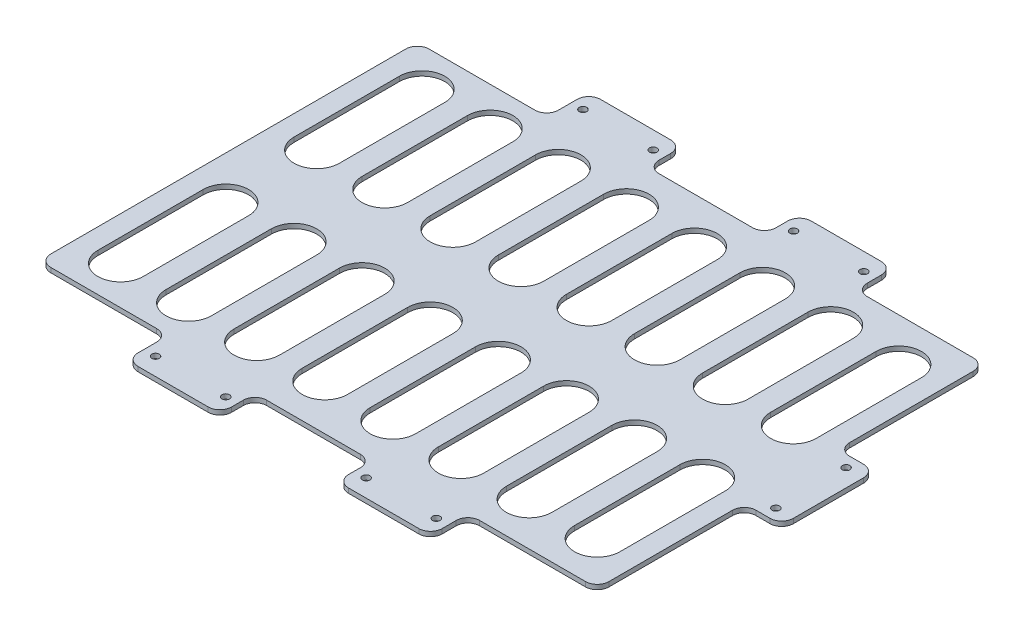
from build123d import *

# Parameters (mm, degrees)
SKETCH_1_R          = 1.6
EXTRUDE_1_DEPTH     = 2
CUT_EXTRUDE_3_DEPTH = 169.328378846
CUT_EXTRUDE_4_DEPTH = 169.328378846
FILLET_2_R          = 5


with BuildPart() as part:
    # 草图1 → 凸台-拉伸1 (new body)
    with BuildSketch(Plane(origin=(0, 0, 0), x_dir=(1, 0, 0), z_dir=(0, 1, 0))):
        Polygon((-121.25, 83.825), (-121.25, -83.825), (-65, -83.825), (-65, -98.825), (-25, -98.825), (-25, -83.825), (25, -83.825), (25, -98.825), (65, -98.825), (65, -83.825), (121.25, -83.825), (121.25, -20), (136.25, -20), (136.25, 20), (121.25, 20), (121.25, 83.825), (65, 83.825), (65, 98.825), (25, 98.825), (25, 83.825), (-25, 83.825), (-25, 98.825), (-65, 98.825), (-65, 83.825), align=None)
        with Locations(Location((-30, -91.325, 0), (0, 0, 270))):
            Circle(SKETCH_1_R, mode=Mode.SUBTRACT)
        with Locations(Location((-60, -91.325, 0), (0, 0, 270))):
            Circle(SKETCH_1_R, mode=Mode.SUBTRACT)
        with Locations(Location((-30, 91.325, 0), (0, 0, 270))):
            Circle(SKETCH_1_R, mode=Mode.SUBTRACT)
        with Locations(Location((-60, 91.325, 0), (0, 0, 270))):
            Circle(SKETCH_1_R, mode=Mode.SUBTRACT)
        with Locations(Location((60, -91.325, 0), (0, 0, 270))):
            Circle(SKETCH_1_R, mode=Mode.SUBTRACT)
        with Locations(Location((30, -91.325, 0), (0, 0, 270))):
            Circle(SKETCH_1_R, mode=Mode.SUBTRACT)
        with Locations(Location((60, 91.325, 0), (0, 0, 270))):
            Circle(SKETCH_1_R, mode=Mode.SUBTRACT)
        with Locations(Location((30, 91.325, 0), (0, 0, 270))):
            Circle(SKETCH_1_R, mode=Mode.SUBTRACT)
        with Locations(Location((128.75, 15, 0), (0, 0, 270))):
            Circle(SKETCH_1_R, mode=Mode.SUBTRACT)
        with Locations(Location((128.75, -15, 0), (0, 0, 270))):
            Circle(SKETCH_1_R, mode=Mode.SUBTRACT)
    extrude(amount=EXTRUDE_1_DEPTH)

    # 草图4 → 切除-拉伸3 (cut, through all)
    with BuildSketch(Plane(origin=(0, 2, 0), x_dir=(1, 0, 0), z_dir=(0, 1, 0))):
        with BuildLine():
            Line((-92.15, 64.425), (-92.15, 19.4))
            ThreePointArc((-92.15, 19.4), (-101.85, 9.7), (-111.55, 19.4))
            Line((-111.55, 19.4), (-111.55, 64.425))
            ThreePointArc((-111.55, 64.425), (-101.85, 74.125), (-92.15, 64.425))
        make_face()
        with BuildLine():
            Line((-63.05, 64.425), (-63.05, 19.4))
            ThreePointArc((-63.05, 19.4), (-72.75, 9.7), (-82.45, 19.4))
            Line((-82.45, 19.4), (-82.45, 64.425))
            ThreePointArc((-82.45, 64.425), (-72.75, 74.125), (-63.05, 64.425))
        make_face()
        with BuildLine():
            Line((-33.95, 64.425), (-33.95, 19.4))
            ThreePointArc((-33.95, 19.4), (-43.65, 9.7), (-53.35, 19.4))
            Line((-53.35, 19.4), (-53.35, 64.425))
            ThreePointArc((-53.35, 64.425), (-43.65, 74.125), (-33.95, 64.425))
        make_face()
        with BuildLine():
            Line((-4.85, 64.425), (-4.85, 19.4))
            ThreePointArc((-4.85, 19.4), (-14.55, 9.7), (-24.25, 19.4))
            Line((-24.25, 19.4), (-24.25, 64.425))
            ThreePointArc((-24.25, 64.425), (-14.55, 74.125), (-4.85, 64.425))
        make_face()
        with BuildLine():
            Line((24.25, 64.425), (24.25, 19.4))
            ThreePointArc((24.25, 19.4), (14.55, 9.7), (4.85, 19.4))
            Line((4.85, 19.4), (4.85, 64.425))
            ThreePointArc((4.85, 64.425), (14.55, 74.125), (24.25, 64.425))
        make_face()
        with BuildLine():
            Line((53.35, 64.425), (53.35, 19.4))
            ThreePointArc((53.35, 19.4), (43.65, 9.7), (33.95, 19.4))
            Line((33.95, 19.4), (33.95, 64.425))
            ThreePointArc((33.95, 64.425), (43.65, 74.125), (53.35, 64.425))
        make_face()
        with BuildLine():
            Line((82.45, 64.425), (82.45, 19.4))
            ThreePointArc((82.45, 19.4), (72.75, 9.7), (63.05, 19.4))
            Line((63.05, 19.4), (63.05, 64.425))
            ThreePointArc((63.05, 64.425), (72.75, 74.125), (82.45, 64.425))
        make_face()
        with BuildLine():
            Line((111.55, 64.425), (111.55, 19.4))
            ThreePointArc((111.55, 19.4), (101.85, 9.7), (92.15, 19.4))
            Line((92.15, 19.4), (92.15, 64.425))
            ThreePointArc((92.15, 64.425), (101.85, 74.125), (111.55, 64.425))
        make_face()
        with BuildLine():
            Line((111.55, -64.425), (111.55, -19.4))
            ThreePointArc((111.55, -19.4), (101.85, -9.7), (92.15, -19.4))
            Line((92.15, -19.4), (92.15, -64.425))
            ThreePointArc((92.15, -64.425), (101.85, -74.125), (111.55, -64.425))
        make_face()
        with BuildLine():
            Line((82.45, -64.425), (82.45, -19.4))
            ThreePointArc((82.45, -19.4), (72.75, -9.7), (63.05, -19.4))
            Line((63.05, -19.4), (63.05, -64.425))
            ThreePointArc((63.05, -64.425), (72.75, -74.125), (82.45, -64.425))
        make_face()
        with BuildLine():
            Line((53.35, -64.425), (53.35, -19.4))
            ThreePointArc((53.35, -19.4), (43.65, -9.7), (33.95, -19.4))
            Line((33.95, -19.4), (33.95, -64.425))
            ThreePointArc((33.95, -64.425), (43.65, -74.125), (53.35, -64.425))
        make_face()
        with BuildLine():
            Line((24.25, -64.425), (24.25, -19.4))
            ThreePointArc((24.25, -19.4), (14.55, -9.7), (4.85, -19.4))
            Line((4.85, -19.4), (4.85, -64.425))
            ThreePointArc((4.85, -64.425), (14.55, -74.125), (24.25, -64.425))
        make_face()
        with BuildLine():
            Line((-4.85, -64.425), (-4.85, -19.4))
            ThreePointArc((-4.85, -19.4), (-14.55, -9.7), (-24.25, -19.4))
            Line((-24.25, -19.4), (-24.25, -64.425))
            ThreePointArc((-24.25, -64.425), (-14.55, -74.125), (-4.85, -64.425))
        make_face()
        with BuildLine():
            Line((-33.95, -64.425), (-33.95, -19.4))
            ThreePointArc((-33.95, -19.4), (-43.65, -9.7), (-53.35, -19.4))
            Line((-53.35, -19.4), (-53.35, -64.425))
            ThreePointArc((-53.35, -64.425), (-43.65, -74.125), (-33.95, -64.425))
        make_face()
        with BuildLine():
            Line((-63.05, -64.425), (-63.05, -19.4))
            ThreePointArc((-63.05, -19.4), (-72.75, -9.7), (-82.45, -19.4))
            Line((-82.45, -19.4), (-82.45, -64.425))
            ThreePointArc((-82.45, -64.425), (-72.75, -74.125), (-63.05, -64.425))
        make_face()
        with BuildLine():
            Line((-92.15, -64.425), (-92.15, -19.4))
            ThreePointArc((-92.15, -19.4), (-101.85, -9.7), (-111.55, -19.4))
            Line((-111.55, -19.4), (-111.55, -64.425))
            ThreePointArc((-111.55, -64.425), (-101.85, -74.125), (-92.15, -64.425))
        make_face()
    extrude(amount=-CUT_EXTRUDE_3_DEPTH, mode=Mode.SUBTRACT)

    # 草图5 → 切除-拉伸4 (cut, through all)
    with BuildSketch(Plane(origin=(0, 2, 0), x_dir=(1, 0, 0), z_dir=(0, 1, 0))):
        Polygon((-65, 83.825), (-65, 80.825), (-120.25, 80.825), (-120.25, -80.825), (-65, -80.825), (-65, -83.825), (-121.25, -83.825), (-121.25, 83.825), align=None)
        Polygon((65, -83.825), (65, -82.825), (120.25, -82.825), (120.25, -20), (121.25, -20), (121.25, -83.825), align=None)
        Polygon((121.25, 20), (120.25, 20), (120.25, 82.825), (65, 82.825), (65, 83.825), (121.25, 83.825), align=None)
    extrude(amount=-CUT_EXTRUDE_4_DEPTH, mode=Mode.SUBTRACT)

    # 圆角2
    fillet_2_edges = [part.edges().sort_by_distance(p)[0] for p in [
        (-65, 1, -80.825),
        (-120.25, 1, -80.825),
        (-120.25, 1, 80.825),
        (-65, 1, 80.825),
        (65, 1, 82.825),
        (120.25, 1, 82.825),
        (120.25, 1, 20),
        (120.25, 1, -20),
        (120.25, 1, -82.825),
        (65, 1, -82.825),
        (-65, 1, -98.825),
        (-25, 1, -98.825),
        (-25, 1, -83.825),
        (25, 1, -83.825),
        (25, 1, -98.825),
        (65, 1, -98.825),
        (136.25, 1, -20),
        (136.25, 1, 20),
        (65, 1, 98.825),
        (25, 1, 98.825),
        (25, 1, 83.825),
        (-25, 1, 83.825),
        (-25, 1, 98.825),
        (-65, 1, 98.825),
    ]]
    fillet(fillet_2_edges, radius=FILLET_2_R)


solid = part.part
